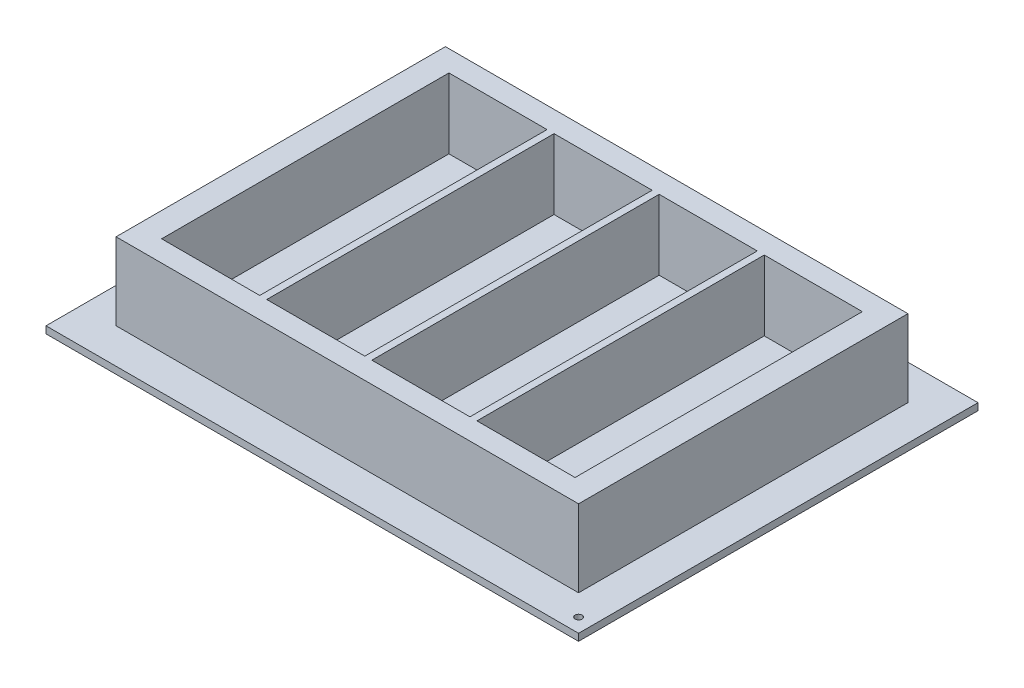
from build123d import *

# Parameters (mm, degrees)
SKETCH1_W           = 66
SKETCH1_H           = 47
SKETCH1_W_2         = 59
SKETCH1_H_2         = 41
BOSS_EXTRUDE1_DEPTH = 10
SKETCH3_W           = 66
SKETCH3_H           = 47
BOSS_EXTRUDE2_DEPTH = 1
SKETCH6_W           = 1
SKETCH6_H           = 41
SKETCH6_W_2         = 0.5
BOSS_EXTRUDE3_DEPTH = 10
SKETCH7_W           = 76
SKETCH7_H           = 57
BOSS_EXTRUDE4_DEPTH = 1
SKETCH8_R           = 0.5
CUT_EXTRUDE1_DEPTH  = 1


with BuildPart() as part:
    # Sketch1 → Boss-Extrude1 (new body)
    with BuildSketch(Plane(origin=(0, 0, 0), x_dir=(1, 0, 0), z_dir=(0, 1, 0))):
        Rectangle(SKETCH1_W, SKETCH1_H)
        Rectangle(SKETCH1_W_2, SKETCH1_H_2, mode=Mode.SUBTRACT)
    extrude(amount=BOSS_EXTRUDE1_DEPTH)

    # Sketch3 → Boss-Extrude2 (add)
    with BuildSketch(Plane(origin=(0, 0, 0), x_dir=(-1, 0, 0), z_dir=(0, -1, 0))):
        Rectangle(SKETCH3_W, SKETCH3_H)
    extrude(amount=BOSS_EXTRUDE2_DEPTH)

    # Sketch6 → Boss-Extrude3 (add)
    with BuildSketch(Plane(origin=(0, 10, 0), x_dir=(1, 0, 0), z_dir=(0, 1, 0))):
        with Locations((-15, 0)):
            Rectangle(SKETCH6_W, SKETCH6_H)
        with Locations((-0.25, 0)):
            Rectangle(SKETCH6_W_2, SKETCH6_H)
        with Locations((0.25, 0)):
            Rectangle(SKETCH6_W_2, SKETCH6_H)
        with Locations((15, 0)):
            Rectangle(SKETCH6_W, SKETCH6_H)
    extrude(amount=-BOSS_EXTRUDE3_DEPTH)

    # Sketch7 → Boss-Extrude4 (add)
    with BuildSketch(Plane(origin=(0, -1, 0), x_dir=(-1, 0, 0), z_dir=(0, -1, 0))):
        Rectangle(SKETCH7_W, SKETCH7_H)
    extrude(amount=BOSS_EXTRUDE4_DEPTH)

    # Sketch8 → Cut-Extrude1 (cut)
    with BuildSketch(Plane(origin=(0, -1, 0), x_dir=(1, 0, 0), z_dir=(0, 1, 0))):
        with Locations(Location((-36, 26.5, 0), (0, 0, 270))):
            Circle(SKETCH8_R)
        with Locations(Location((36, -26.5, 0), (0, 0, 270))):
            Circle(SKETCH8_R)
    extrude(amount=-CUT_EXTRUDE1_DEPTH, mode=Mode.SUBTRACT)


solid = part.part
